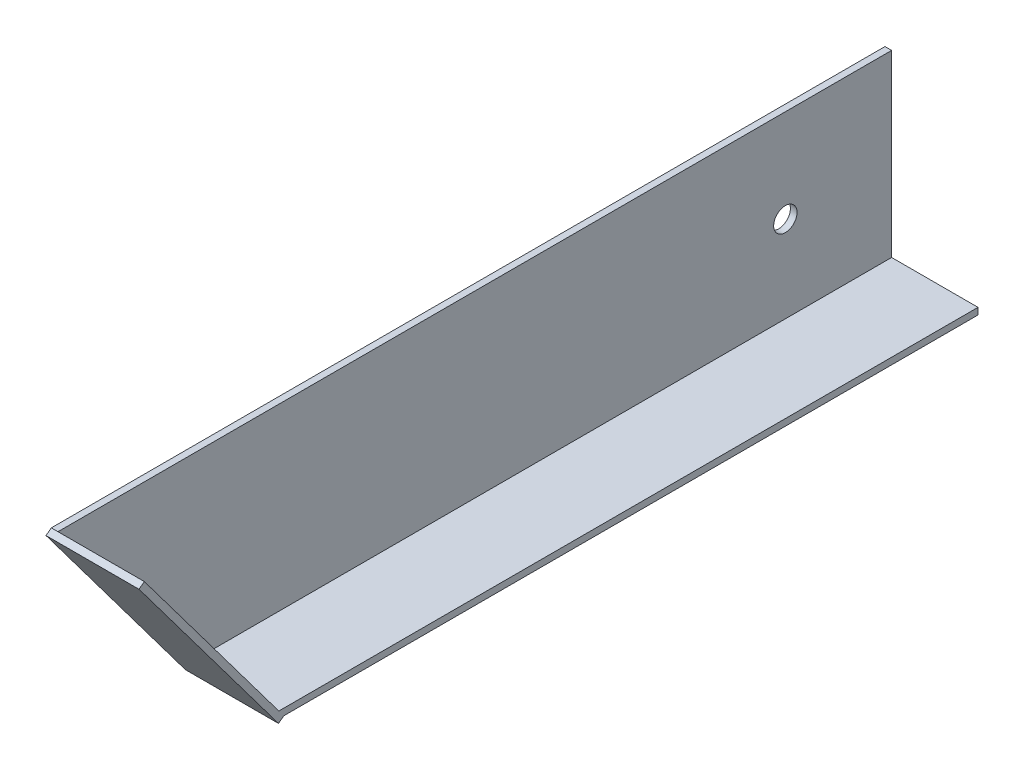
from build123d import *

# Parameters (mm, degrees)
BOSS_EXTRUDE1_DEPTH     = 199.23125
CUT_EXTRUDE3_DEPTH      = 223.035867827
CUT_EXTRUDE3_DEPTH_BACK = 223.035867827
SKETCH4_R               = 5.588
SKETCH5_W               = 44.45
SKETCH5_H               = 111.125148887
BOSS_EXTRUDE3_DEPTH     = 3.175


with BuildPart() as part:
    # Sketch1 → Boss-Extrude1 (new, symmetric)
    with BuildSketch(Plane.XY):
        Polygon((3.175, 88.9), (3.175, 3.175), (44.45, 3.175), (44.45, 0), (0, 0), (0, 88.9), align=None)
    extrude(amount=BOSS_EXTRUDE1_DEPTH, both=True)

    # Sketch4 → Cut-Extrude3 (cut, two sides: drawn at the far end of the back side and taken through both)
    with BuildSketch(Plane(origin=(3.175, 0, 0), x_dir=(0, 0, -1), z_dir=(1, 0, 0)).offset(-CUT_EXTRUDE3_DEPTH_BACK)):
        with Locations(Location((148.43125, 44.45, 0), (0, 0, 270))):
            Circle(SKETCH4_R)
        Polygon((-199.23125, 88.9), (-132.556001855, 0), (-199.23125, 0), align=None)
    extrude(amount=CUT_EXTRUDE3_DEPTH + CUT_EXTRUDE3_DEPTH_BACK, mode=Mode.SUBTRACT)

    # Sketch5 → Boss-Extrude3 (add)
    with BuildSketch(Plane(origin=(0, -63.626947194, 84.835613859), x_dir=(1, 0, 0), z_dir=(0, -0.6000014291326674, 0.7999989281485049))):
        with Locations((22.225, 135.096364997)):
            Rectangle(SKETCH5_W, SKETCH5_H)
    extrude(amount=BOSS_EXTRUDE3_DEPTH)


solid = part.part
